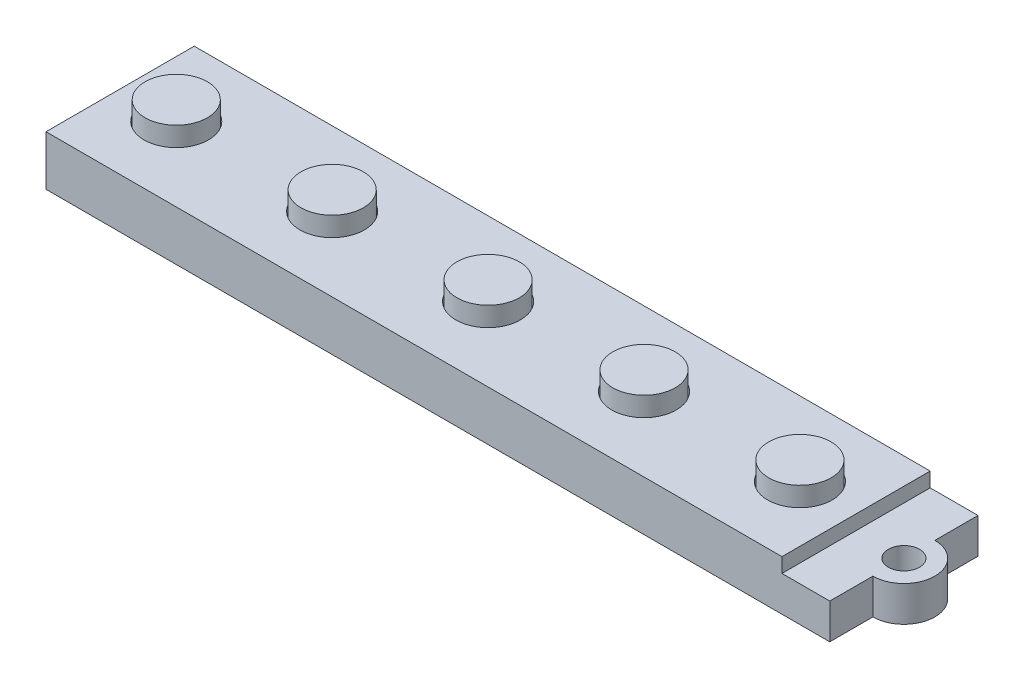
from build123d import *

# Parameters (mm, degrees)
SKETCH1_W           = 99.568
SKETCH1_H           = 18.1102
BOSS_EXTRUDE1_DEPTH = 6.096
SKETCH2_W           = 9.652
SKETCH2_H           = 18.1102
CUT_EXTRUDE1_DEPTH  = 1.778
SKETCH3_R           = 1.905
CUT_EXTRUDE2_DEPTH  = 122.383149472
SKETCH4_R           = 3.937
CUT_EXTRUDE3_DEPTH  = 1.27
SKETCH5_W           = 82.55
SKETCH5_H           = 12.7
BOSS_EXTRUDE2_DEPTH = 1.27
CUT_EXTRUDE4_DEPTH  = 122.434960352
SKETCH8_R           = 3.81
BOSS_EXTRUDE3_DEPTH = 3.556


with BuildPart() as part:
    # Sketch1 → Boss-Extrude1 (new body)
    with BuildSketch(Plane(origin=(0, 0, 0), x_dir=(1, 0, 0), z_dir=(0, 1, 0))):
        with Locations((-66.378666667, 25.894273737)):
            Rectangle(SKETCH1_W, SKETCH1_H)
    extrude(amount=BOSS_EXTRUDE1_DEPTH)

    # Sketch2 → Cut-Extrude1 (cut)
    with BuildSketch(Plane(origin=(0, 6.096, 0), x_dir=(1, 0, 0), z_dir=(0, 1, 0))):
        with Locations((-21.420666667, 25.894273737)):
            Rectangle(SKETCH2_W, SKETCH2_H)
    extrude(amount=-CUT_EXTRUDE1_DEPTH, mode=Mode.SUBTRACT)

    # Sketch3 → Cut-Extrude2 (cut, through all)
    with BuildSketch(Plane(origin=(0, 4.318, 0), x_dir=(1, 0, 0), z_dir=(0, 1, 0))):
        with Locations(Location((-20.404666667, 25.894273737, 0), (0, 0, 270))):
            Circle(SKETCH3_R)
    extrude(amount=-CUT_EXTRUDE2_DEPTH, mode=Mode.SUBTRACT)

    # Sketch4 → Cut-Extrude3 (cut)
    with BuildSketch(Plane(origin=(0, 6.096, 0), x_dir=(1, 0, 0), z_dir=(0, 1, 0))):
        with Locations(Location((-33.104666667, 25.894273737, 0), (0, 0, 270))):
            Circle(SKETCH4_R)
        with Locations(Location((-52.154666667, 25.894273737, 0), (0, 0, 270))):
            Circle(SKETCH4_R)
        with Locations(Location((-71.204666667, 25.894273737, 0), (0, 0, 270))):
            Circle(SKETCH4_R)
        with Locations(Location((-90.254666667, 25.894273737, 0), (0, 0, 270))):
            Circle(SKETCH4_R)
        with Locations(Location((-109.304666667, 25.894273737, 0), (0, 0, 270))):
            Circle(SKETCH4_R)
    extrude(amount=-CUT_EXTRUDE3_DEPTH, mode=Mode.SUBTRACT)

    # Sketch5 → Boss-Extrude2 (add)
    with BuildSketch(Plane.XZ):
        with Locations((-71.204666667, -25.894273737)):
            Rectangle(SKETCH5_W, SKETCH5_H)
    extrude(amount=BOSS_EXTRUDE2_DEPTH)

    # Sketch7 → Cut-Extrude4 (cut, through all)
    with BuildSketch(Plane(origin=(0, 4.318, 0), x_dir=(1, 0, 0), z_dir=(0, 1, 0))):
        with BuildLine():
            Line((-16.594666667, 34.949373737), (-20.404666667, 34.949373737))
            Line((-20.404666667, 34.949373737), (-20.404666667, 29.680045052))
            ThreePointArc((-20.404666667, 29.680045052), (-16.618895352, 25.894273737), (-20.404666667, 22.108502422))
            Line((-20.404666667, 22.108502422), (-20.404666667, 16.839173737))
            Line((-20.404666667, 16.839173737), (-16.594666667, 16.839173737))
            Line((-16.594666667, 16.839173737), (-16.594666667, 34.949373737))
        make_face()
    extrude(amount=-CUT_EXTRUDE4_DEPTH, mode=Mode.SUBTRACT)

    # Sketch8 → Boss-Extrude3 (add)
    with BuildSketch(Plane(origin=(0, 4.826, 0), x_dir=(1, 0, 0), z_dir=(0, 1, 0))):
        with Locations(Location((-33.104666667, 25.894273737, 0), (0, 0, 270))):
            Circle(SKETCH8_R)
        with Locations(Location((-52.154666667, 25.894273737, 0), (0, 0, 270))):
            Circle(SKETCH8_R)
        with Locations(Location((-71.204666667, 25.894273737, 0), (0, 0, 270))):
            Circle(SKETCH8_R)
        with Locations(Location((-90.254666667, 25.894273737, 0), (0, 0, 270))):
            Circle(SKETCH8_R)
        with Locations(Location((-109.304666667, 25.894273737, 0), (0, 0, 270))):
            Circle(SKETCH8_R)
    extrude(amount=BOSS_EXTRUDE3_DEPTH)


solid = part.part
